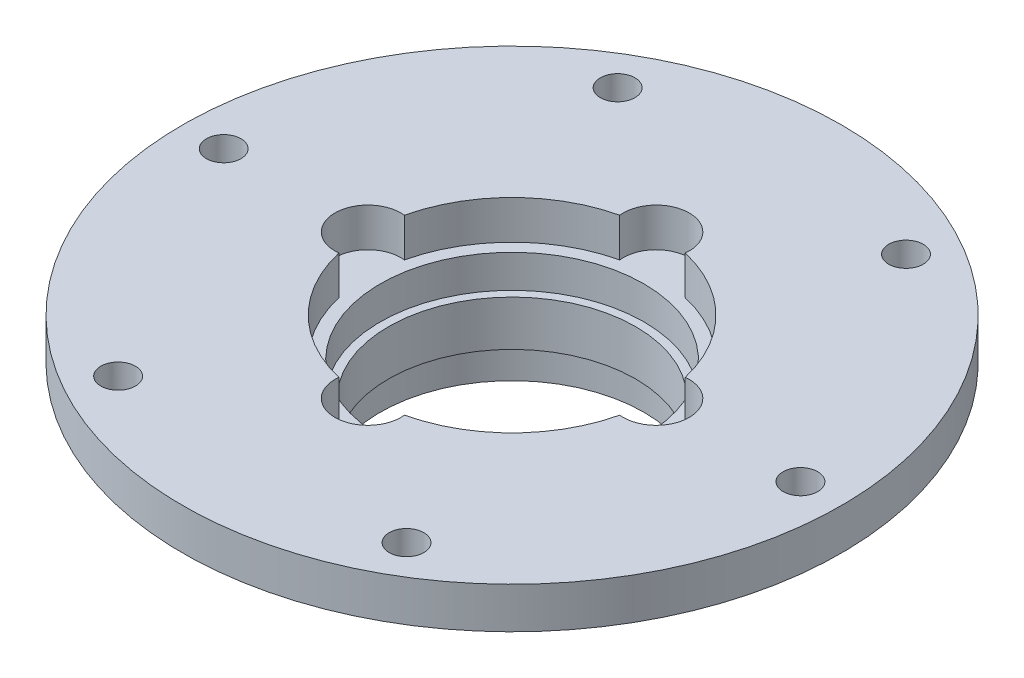
from build123d import *

# Parameters (mm, degrees)
SKETCH_4_R          = 4
CUT_EXTRUDE_1_DEPTH = 4.7
HOLE_WIZARD_M5_1_D  = 4.2


with BuildPart() as part:
    # 草图1 → 旋转1 (revolve)
    with BuildSketch(Plane.XY, mode=Mode.PRIVATE) as revolve_1_sk:
        Polygon((24, 12.2), (24, 6), (19, 6), (19, 0), (19, -1), (16, -1), (16, 0), (16, 3), (15, 3), (15, 8.5), (16, 8.5), (16, 12.5), (17.5, 12.5), (17.5, 17.2), (21.5, 17.2), (40, 17.2), (40, 12.2), align=None)
    revolve(revolve_1_sk.sketch.rotate(Axis((0, 0, 0), (0, 1, 0)), 90), axis=Axis((0, 0, 0), (0, 1, 0)))

    # 草图4 → 切除-拉伸1 (cut)
    with BuildSketch(Plane(origin=(0, 17.2, 0), x_dir=(1, 0, 0), z_dir=(0, 1, 0))):
        with Locations((0, -17.5)):
            Circle(SKETCH_4_R)
        with Locations((17.5, 0)):
            Circle(SKETCH_4_R)
        with Locations((0, 17.5)):
            Circle(SKETCH_4_R)
        with Locations((-17.5, 0)):
            Circle(SKETCH_4_R)
    extrude(amount=-CUT_EXTRUDE_1_DEPTH, mode=Mode.SUBTRACT)

    # M5 螺纹孔1 (through all)
    with Locations(Plane(origin=(17.5, 17.2, -30.310889132), x_dir=(0, 0, 1), z_dir=(0, 1, 0))):
        with Locations((0, 0), (30.310889132, 17.5), (60.621778264, 0), (60.621778264, -35), (30.310889132, -52.5), (0, -35)):
            Hole(HOLE_WIZARD_M5_1_D / 2)


solid = part.part
